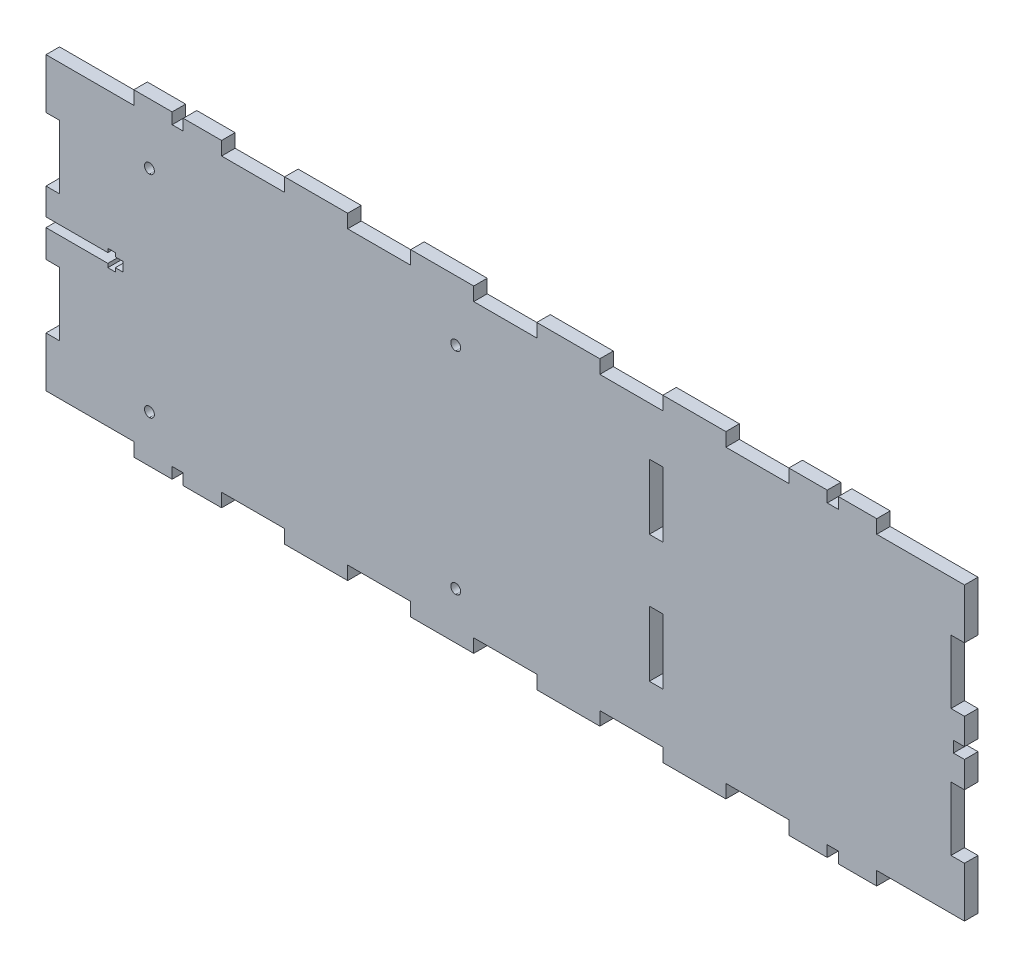
from build123d import *

# Parameters (mm, degrees)
MODEL_W             = 4.499998054
MODEL_H             = 21.693928328
MODEL_H_2           = 21.693787217
BOSS_EXTRUDE1_DEPTH = 4.5


with BuildPart() as part:
    # Model → Boss-Extrude1 (new body)
    with BuildSketch(Plane.XY):
        Polygon((760.050761477, -825.00268896), (747.275655091, -825.00268896), (747.275655091, -829.502687015), (722.525753986, -829.502687015), (718.025755932, -829.502687015), (718.025755932, -846.202798955), (722.525753986, -846.202798955), (722.525753986, -867.402520894), (718.025755932, -867.402520894), (718.025755932, -876.311006448), (738.62589676, -876.311006448), (738.62589676, -875.061150059), (741.125997592, -875.061150059), (741.125997592, -876.311006448), (743.625922036, -876.311006448), (743.625922036, -879.410935336), (741.125997592, -879.410935336), (741.125997592, -880.660791724), (738.62589676, -880.660791724), (738.62589676, -879.410935336), (718.025755932, -879.410935336), (718.025755932, -888.602772), (722.525753986, -888.602772), (722.525753986, -909.802529217), (718.025755932, -909.802529217), (718.025755932, -926.502288379), (747.275655091, -926.502288379), (747.275655091, -931.002251156), (760.050761477, -931.002251156), (760.050761477, -927.30221199), (763.750800642, -927.30221199), (763.750800642, -931.002251156), (776.52555425, -931.002251156), (776.52555425, -926.502288379), (797.525462856, -926.502288379), (797.525462856, -931.002251156), (818.525759518, -931.002251156), (818.525759518, -926.502288379), (839.525668123, -926.502288379), (839.525668123, -931.002251156), (860.525612007, -931.002251156), (860.525612007, -926.502288379), (881.525873391, -926.502288379), (881.525873391, -931.002251156), (902.525781997, -931.002251156), (902.525781997, -926.502288379), (923.52572588, -926.502288379), (923.52572588, -931.002251156), (944.525634486, -931.002251156), (944.525634486, -926.502288379), (965.52557837, -926.502288379), (965.52557837, -931.002251156), (978.300649478, -931.002251156), (978.300649478, -927.30221199), (982.000688643, -927.30221199), (982.000688643, -931.002251156), (994.775795029, -931.002251156), (994.775795029, -926.502288379), (1024.025694188, -926.502288379), (1024.025694188, -909.802529217), (1019.525696134, -909.802529217), (1019.525696134, -888.602772), (1024.025694188, -888.602772), (1024.025694188, -879.852225058), (1020.325655023, -879.852225058), (1020.325655023, -876.152715059), (1024.025694188, -876.152715059), (1024.025694188, -867.402520894), (1019.525696134, -867.402520894), (1019.525696134, -846.202798955), (1024.025694188, -846.202798955), (1024.025694188, -829.502687015), (1019.525696134, -829.502687015), (994.775442251, -829.502687015), (994.775442251, -825.00268896), (982.000688643, -825.00268896), (982.000688643, -828.702728126), (978.300649478, -828.702728126), (978.300649478, -825.00268896), (965.52557837, -825.00268896), (965.52557837, -829.502687015), (944.525634486, -829.502687015), (944.525634486, -825.00268896), (923.52572588, -825.00268896), (923.52572588, -829.502687015), (902.525429219, -829.502687015), (902.525429219, -825.00268896), (881.525520613, -825.00268896), (881.525520613, -829.502687015), (860.525612007, -829.502687015), (860.525612007, -825.00268896), (839.525668123, -825.00268896), (839.525668123, -829.502687015), (818.525759518, -829.502687015), (818.525759518, -825.00268896), (797.525462856, -825.00268896), (797.525462856, -829.502687015), (776.52555425, -829.502687015), (776.52555425, -825.00268896), (763.750800642, -825.00268896), (763.750800642, -828.702728126), (760.050761477, -828.702728126), align=None)
        with Locations((921.275726853, -856.555380341)):
            Rectangle(MODEL_W, MODEL_H, mode=Mode.SUBTRACT)
        with Locations((921.275726853, -898.955635608)):
            Rectangle(MODEL_W, MODEL_H_2, mode=Mode.SUBTRACT)
        with BuildLine():
            add(Edge.make_bspline(
                [(752.476022867, -917.002758937), (751.564797868, -917.002758937), (750.826187035, -916.264148104), (750.826187035, -915.352570327), (750.826187035, -914.441698105), (751.564797868, -913.702381716), (752.476022867, -913.702381716)],
                knots=[2, 2, 2, 2, 3, 3, 3, 4, 4, 4, 4], degree=3))
            add(Edge.make_bspline(
                [(752.476022867, -913.702381716), (753.387247867, -913.702381716), (754.126246756, -914.441698105), (754.126246756, -915.352570327), (754.126246756, -916.264148104), (753.387247867, -917.002758937), (752.476022867, -917.002758937)],
                knots=[0, 0, 0, 0, 1, 1, 1, 2, 2, 2, 2], degree=3))
        make_face(mode=Mode.SUBTRACT)
        with BuildLine():
            add(Edge.make_bspline(
                [(752.476022867, -846.739021177), (751.564797868, -846.739021177), (750.826187035, -846.000375066), (750.826187035, -845.088797289), (750.826187035, -844.177925067), (751.564797868, -843.438608678), (752.476022867, -843.438608678)],
                knots=[2, 2, 2, 2, 3, 3, 3, 4, 4, 4, 4], degree=3))
            add(Edge.make_bspline(
                [(752.476022867, -843.438608678), (753.387247867, -843.438608678), (754.126246756, -844.177925067), (754.126246756, -845.088797289), (754.126246756, -846.000375066), (753.387247867, -846.739021177), (752.476022867, -846.739021177)],
                knots=[0, 0, 0, 0, 1, 1, 1, 2, 2, 2, 2], degree=3))
        make_face(mode=Mode.SUBTRACT)
        with BuildLine():
            add(Edge.make_bspline(
                [(854.523909509, -917.002758937), (853.61282562, -917.002758937), (852.874214787, -916.264148104), (852.874214787, -915.352570327), (852.874214787, -914.441698105), (853.61282562, -913.702381716), (854.523909509, -913.702381716)],
                knots=[2, 2, 2, 2, 3, 3, 3, 4, 4, 4, 4], degree=3))
            add(Edge.make_bspline(
                [(854.523909509, -913.702381716), (855.435452008, -913.702381716), (856.174274508, -914.441698105), (856.174274508, -915.352570327), (856.174274508, -916.264148104), (855.435452008, -917.002758937), (854.523909509, -917.002758937)],
                knots=[0, 0, 0, 0, 1, 1, 1, 2, 2, 2, 2], degree=3))
        make_face(mode=Mode.SUBTRACT)
        with BuildLine():
            add(Edge.make_bspline(
                [(854.523909509, -846.738844788), (853.61282562, -846.738844788), (852.874214787, -846.000198677), (852.874214787, -845.088656178), (852.874214787, -844.177748678), (853.61282562, -843.438432289), (854.523909509, -843.438432289)],
                knots=[2, 2, 2, 2, 3, 3, 3, 4, 4, 4, 4], degree=3))
            add(Edge.make_bspline(
                [(854.523909509, -843.438432289), (855.435452008, -843.438432289), (856.174274508, -844.177748678), (856.174274508, -845.088656178), (856.174274508, -846.000198677), (855.435452008, -846.738844788), (854.523909509, -846.738844788)],
                knots=[0, 0, 0, 0, 1, 1, 1, 2, 2, 2, 2], degree=3))
        make_face(mode=Mode.SUBTRACT)
    extrude(amount=BOSS_EXTRUDE1_DEPTH)


solid = part.part
